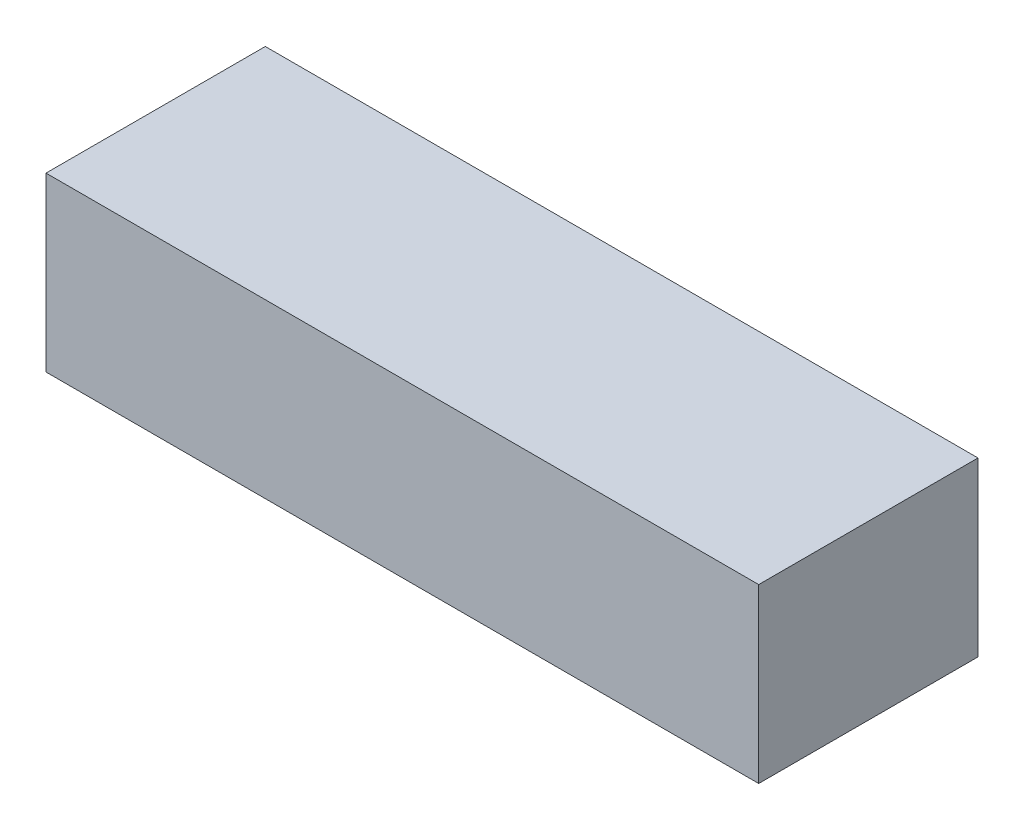
from build123d import *

# Parameters (mm, degrees)
SKETCH_1_W      = 91
SKETCH_1_H      = 28
EXTRUDE_1_DEPTH = 22


with BuildPart() as part:
    # 草图1 → 凸台-拉伸1 (new body)
    with BuildSketch(Plane(origin=(0, 0, 0), x_dir=(1, 0, 0), z_dir=(0, 1, 0))):
        with Locations((45.5, -14)):
            Rectangle(SKETCH_1_W, SKETCH_1_H)
    extrude(amount=EXTRUDE_1_DEPTH)


solid = part.part
